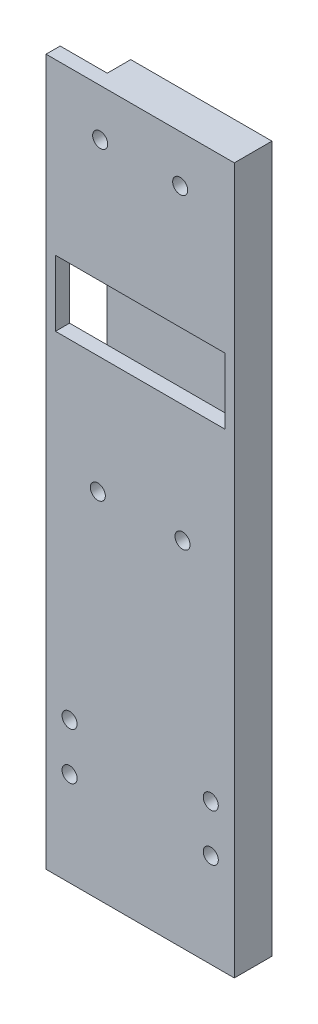
from build123d import *

# Parameters (mm, degrees)
SKETCH1_W           = 40
SKETCH1_H           = 150
BOSS_EXTRUDE1_DEPTH = 8
SKETCH2_W           = 10
SKETCH2_H           = 150
CUT_EXTRUDE1_DEPTH  = 5
SKETCH5_R           = 1.6
CUT_EXTRUDE2_DEPTH  = 35
SKETCH6_W           = 36
SKETCH6_H           = 14
CUT_EXTRUDE3_DEPTH  = 3
SKETCH7_R           = 1.6
CUT_EXTRUDE4_DEPTH  = 10
SKETCH8_R           = 1.6
CUT_EXTRUDE5_DEPTH  = 10
SKETCH9_R           = 1.6
CUT_EXTRUDE6_DEPTH  = 10


with BuildPart() as part:
    # Sketch1 → Boss-Extrude1 (new body)
    with BuildSketch(Plane.XY):
        with Locations((1.904761905, -44.285714286)):
            Rectangle(SKETCH1_W, SKETCH1_H)
    extrude(amount=BOSS_EXTRUDE1_DEPTH)

    # Sketch2 → Cut-Extrude1 (cut)
    with BuildSketch(Plane.XY):
        with Locations((-13.095238095, -44.285714286)):
            Rectangle(SKETCH2_W, SKETCH2_H)
    extrude(amount=CUT_EXTRUDE1_DEPTH, mode=Mode.SUBTRACT)

    # Sketch5 → Cut-Extrude2 (cut)
    with BuildSketch(Plane.XY.offset(8)):
        with Locations((10.404761905, 20.714285714)):
            Circle(SKETCH5_R)
        with Locations((-6.595238095, 20.714285714)):
            Circle(SKETCH5_R)
    extrude(amount=-CUT_EXTRUDE2_DEPTH, mode=Mode.SUBTRACT)

    # Sketch6 → Cut-Extrude3 (cut)
    with BuildSketch(Plane.XY.offset(8)):
        with Locations((1.904761905, -12.285714286)):
            Rectangle(SKETCH6_W, SKETCH6_H)
    extrude(amount=-CUT_EXTRUDE3_DEPTH, mode=Mode.SUBTRACT)

    # Sketch7 → Cut-Extrude4 (cut)
    with BuildSketch(Plane.XY.offset(8)):
        with Locations((-7.095238095, -44.285714286)):
            Circle(SKETCH7_R)
        with Locations((10.904761905, -44.285714286)):
            Circle(SKETCH7_R)
    extrude(amount=-CUT_EXTRUDE4_DEPTH, mode=Mode.SUBTRACT)

    # Sketch8 → Cut-Extrude5 (cut)
    with BuildSketch(Plane.XY.offset(8)):
        with Locations((-13.095238095, -89.285714286)):
            Circle(SKETCH8_R)
        with Locations((16.904761905, -89.285714286)):
            Circle(SKETCH8_R)
    extrude(amount=-CUT_EXTRUDE5_DEPTH, mode=Mode.SUBTRACT)

    # Sketch9 → Cut-Extrude6 (cut)
    with BuildSketch(Plane.XY.offset(8)):
        with Locations((-13.095238095, -99.285714286)):
            Circle(SKETCH9_R)
        with Locations((16.904761905, -99.285714286)):
            Circle(SKETCH9_R)
    extrude(amount=-CUT_EXTRUDE6_DEPTH, mode=Mode.SUBTRACT)


solid = part.part
